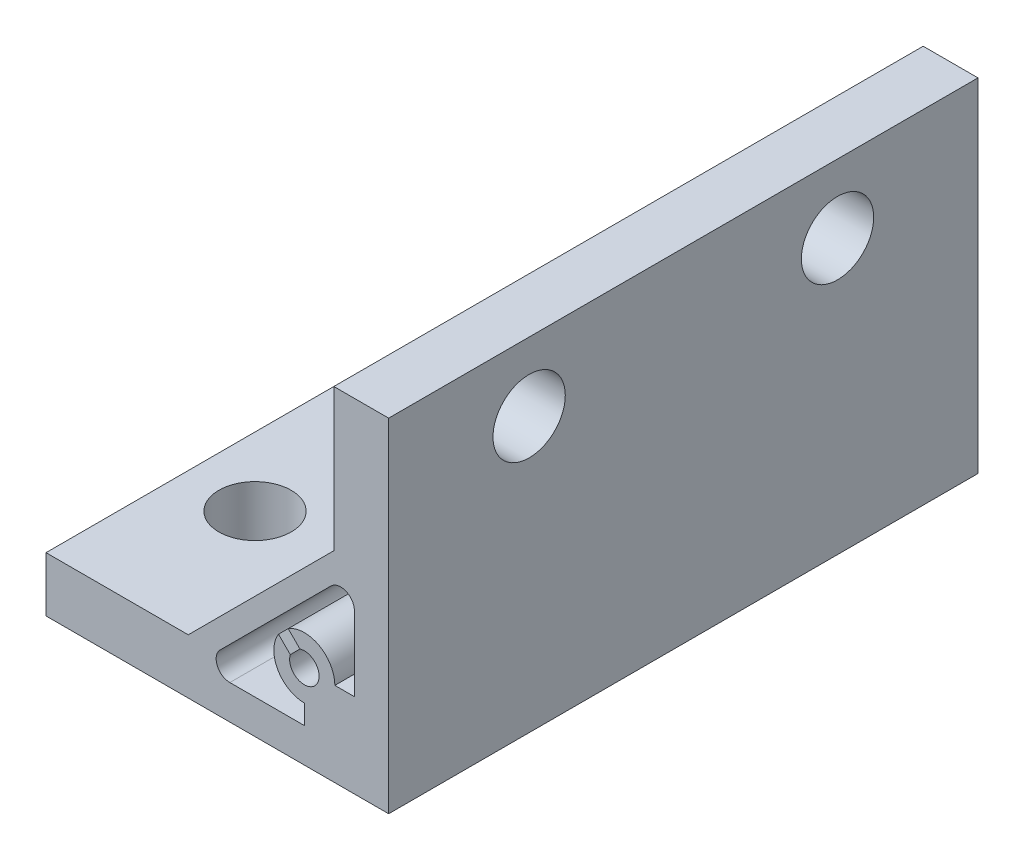
from build123d import *

# Parameters (mm, degrees)
EXTRUDE_1_DEPTH     = 43
SKETCH_3_R          = 5.276684378
CUT_EXTRUDE_1_DEPTH = 79.185676438


with BuildPart() as part:
    # 草图1 → 凸台-拉伸1 (new, symmetric)
    with BuildSketch(Plane.XY):
        Polygon((0, 0), (50, 0), (50, 50), (42, 50), (42, 29.242640687), (20.757359313, 8), (0, 8), align=None)
        with BuildLine():
            Line((37.061279898, 14.352933665), (35.340960992, 16.07325257))
            ThreePointArc((35.340960992, 16.07325257), (39.856939547, 16.192314452), (42.15, 12.3))
            Line((42.15, 12.3), (45, 12.3))
            Line((45, 12.3), (45, 23.171572875))
            ThreePointArc((45, 23.171572875), (43.765366865, 25.01933194), (41.585786438, 24.585786438))
            Line((41.585786438, 24.585786438), (25.414213562, 8.414213562))
            ThreePointArc((25.414213562, 8.414213562), (24.98066806, 6.234633135), (26.828427125, 5))
            Line((26.828427125, 5), (37.7, 5))
            Line((37.7, 5), (37.7, 7.85))
            ThreePointArc((37.7, 7.85), (33.807685548, 10.143060453), (33.92674743, 14.659039008))
            Line((33.92674743, 14.659039008), (35.647066335, 12.938720102))
            ThreePointArc((35.647066335, 12.938720102), (39.22027958, 10.77972042), (37.061279898, 14.352933665))
        make_face(mode=Mode.SUBTRACT)
    extrude(amount=EXTRUDE_1_DEPTH, both=True)

    # 草图3 → 切除-拉伸1 (cut, through all)
    with BuildSketch(Plane(origin=(0, 8, 0), x_dir=(1, 0, 0), z_dir=(0, 1, 0))):
        with Locations(Location((10, 22.5, 0), (0, 0, 270))):
            Circle(SKETCH_3_R)
        with Locations(Location((10, -22.5, 0), (0, 0, 90))):
            Circle(SKETCH_3_R)
    cut_extrude_1 = extrude(amount=-CUT_EXTRUDE_1_DEPTH, mode=Mode.SUBTRACT)

    # 镜向1: 切除-拉伸1 across plane
    add(cut_extrude_1.mirror(Plane(origin=(25, 25, 0), x_dir=(0, 0, 1), z_dir=(-0.7071067811865486, -0.7071067811865465, 0))), mode=Mode.SUBTRACT)


solid = part.part
